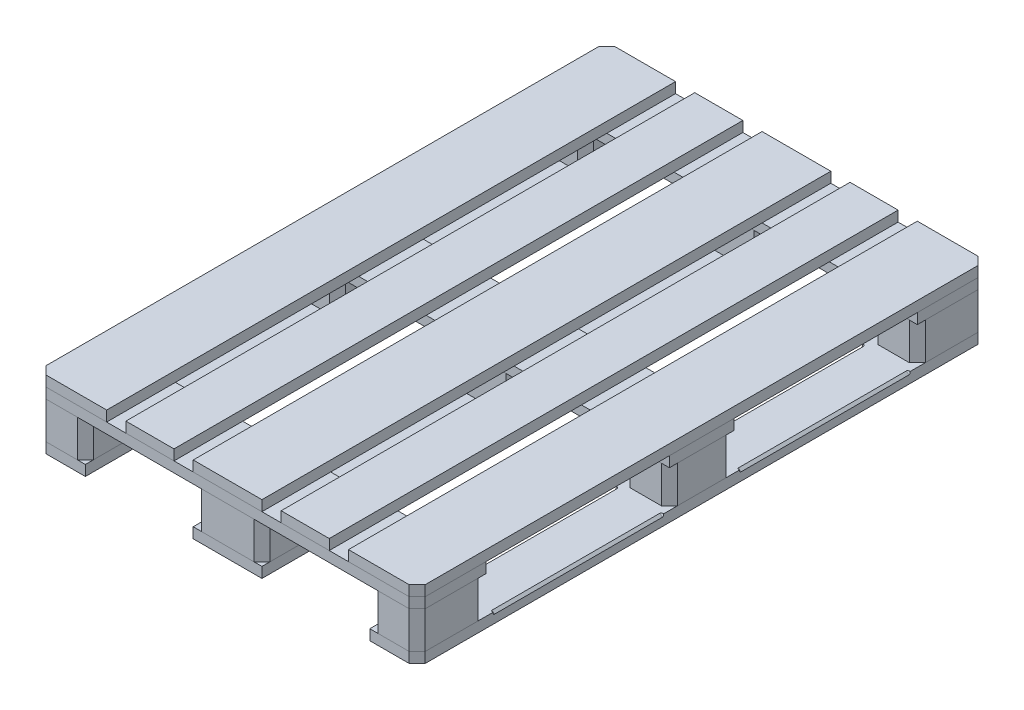
from build123d import *

# Parameters (mm, degrees)
BOSS_EXTRUDE1_DEPTH        = 600
BOSS_EXTRUDE1_DEPTH_BACK   = 600
SKETCH3_W                  = 100
SKETCH3_H                  = 22
BOSS_EXTRUDE1_2_DEPTH      = 600
BOSS_EXTRUDE1_2_DEPTH_BACK = 600
SKETCH3_W_2                = 145
BOSS_EXTRUDE1_3_DEPTH      = 600
BOSS_EXTRUDE1_3_DEPTH_BACK = 600
BOSS_EXTRUDE2_DEPTH        = 78
BOSS_EXTRUDE2_2_DEPTH      = 78
BOSS_EXTRUDE2_3_DEPTH      = 78
BOSS_EXTRUDE2_4_DEPTH      = 78
BOSS_EXTRUDE2_5_DEPTH      = 78
BOSS_EXTRUDE2_6_DEPTH      = 78
BOSS_EXTRUDE2_7_DEPTH      = 78
BOSS_EXTRUDE2_8_DEPTH      = 78
BOSS_EXTRUDE2_9_DEPTH      = 78
SKETCH5_W                  = 800
SKETCH5_H                  = 145
BOSS_EXTRUDE3_DEPTH        = 22
SKETCH5_H_2                = 136
BOSS_EXTRUDE3_2_DEPTH      = 22
BOSS_EXTRUDE3_3_DEPTH      = 22
SKETCH6_W                  = 145
SKETCH6_H                  = 1200
BOSS_EXTRUDE4_DEPTH        = 22
BOSS_EXTRUDE4_2_DEPTH      = 22
BOSS_EXTRUDE4_3_DEPTH      = 22
SKETCH6_W_2                = 101.5
BOSS_EXTRUDE4_4_DEPTH      = 22
BOSS_EXTRUDE4_5_DEPTH      = 22
CUT_EXTRUDE1_DEPTH         = 732.35764165
CUT_EXTRUDE1_DEPTH_BACK    = 732.35764165
CUT_EXTRUDE2_START         = 80
CUT_EXTRUDE2_DEPTH         = 360
CUT_EXTRUDE3_START         = -80
CUT_EXTRUDE3_DEPTH         = 360
FILLET1_R                  = 3
FILLET2_R                  = 3
FILLET3_R                  = 3


with BuildPart() as part:
    # Sketch3 → Boss-Extrude1 (new, two sides: drawn at the far end of the back side and taken through both)
    with BuildSketch(Plane.XY.offset(-BOSS_EXTRUDE1_DEPTH_BACK)):
        with Locations((-350, -61)):
            Rectangle(SKETCH3_W, SKETCH3_H)
    extrude(amount=BOSS_EXTRUDE1_DEPTH + BOSS_EXTRUDE1_DEPTH_BACK)


with BuildPart() as body_2:
    # Sketch3 → Boss-Extrude1 2 (new, two sides: drawn at the far end of the back side and taken through both)
    with BuildSketch(Plane.XY.offset(-BOSS_EXTRUDE1_2_DEPTH_BACK)):
        with Locations((0, -61)):
            Rectangle(SKETCH3_W_2, SKETCH3_H)
    extrude(amount=BOSS_EXTRUDE1_2_DEPTH + BOSS_EXTRUDE1_2_DEPTH_BACK)


with BuildPart() as body_3:
    # Sketch3 → Boss-Extrude1 3 (new, two sides: drawn at the far end of the back side and taken through both)
    with BuildSketch(Plane.XY.offset(-BOSS_EXTRUDE1_3_DEPTH_BACK)):
        with Locations((350, -61)):
            Rectangle(SKETCH3_W, SKETCH3_H)
    extrude(amount=BOSS_EXTRUDE1_3_DEPTH + BOSS_EXTRUDE1_3_DEPTH_BACK)


with BuildPart() as body_4:
    # Sketch4 → Boss-Extrude2 (new body)
    with BuildSketch(Plane(origin=(0, -50, 0), x_dir=(1, 0, 0), z_dir=(0, 1, 0))):
        Polygon((-55.5, -600), (55.5, -600), (72.5, -583), (72.5, -472), (55.5, -455), (-55.5, -455), (-72.5, -472), (-72.5, -583), align=None)
    extrude(amount=BOSS_EXTRUDE2_DEPTH)


with BuildPart() as body_5:
    # Sketch4 → Boss-Extrude2 2 (new body)
    with BuildSketch(Plane(origin=(0, -50, 0), x_dir=(1, 0, 0), z_dir=(0, 1, 0))):
        Polygon((55.5, 600), (-55.5, 600), (-72.5, 583), (-72.5, 472), (-55.5, 455), (55.5, 455), (72.5, 472), (72.5, 583), align=None)
    extrude(amount=BOSS_EXTRUDE2_2_DEPTH)


with BuildPart() as body_6:
    # Sketch4 → Boss-Extrude2 3 (new body)
    with BuildSketch(Plane(origin=(0, -50, 0), x_dir=(1, 0, 0), z_dir=(0, 1, 0))):
        Polygon((383, 600), (317, 600), (300, 583), (300, 472), (317, 455), (383, 455), (400, 472), (400, 583), align=None)
    extrude(amount=BOSS_EXTRUDE2_3_DEPTH)


with BuildPart() as body_7:
    # Sketch4 → Boss-Extrude2 4 (new body)
    with BuildSketch(Plane(origin=(0, -50, 0), x_dir=(1, 0, 0), z_dir=(0, 1, 0))):
        Polygon((-55.5, 68), (55.5, 68), (72.5, 51), (72.5, -51), (55.5, -68), (-55.5, -68), (-72.5, -51), (-72.5, 51), align=None)
    extrude(amount=BOSS_EXTRUDE2_4_DEPTH)


with BuildPart() as body_8:
    # Sketch4 → Boss-Extrude2 5 (new body)
    with BuildSketch(Plane(origin=(0, -50, 0), x_dir=(1, 0, 0), z_dir=(0, 1, 0))):
        Polygon((-317, 600), (-383, 600), (-400, 583), (-400, 472), (-383, 455), (-317, 455), (-300, 472), (-300, 583), align=None)
    extrude(amount=BOSS_EXTRUDE2_5_DEPTH)


with BuildPart() as body_9:
    # Sketch4 → Boss-Extrude2 6 (new body)
    with BuildSketch(Plane(origin=(0, -50, 0), x_dir=(1, 0, 0), z_dir=(0, 1, 0))):
        Polygon((-383, -600), (-317, -600), (-300, -583), (-300, -472), (-317, -455), (-383, -455), (-400, -472), (-400, -583), align=None)
    extrude(amount=BOSS_EXTRUDE2_6_DEPTH)


with BuildPart() as body_10:
    # Sketch4 → Boss-Extrude2 7 (new body)
    with BuildSketch(Plane(origin=(0, -50, 0), x_dir=(1, 0, 0), z_dir=(0, 1, 0))):
        Polygon((317, -600), (383, -600), (400, -583), (400, -472), (383, -455), (317, -455), (300, -472), (300, -583), align=None)
    extrude(amount=BOSS_EXTRUDE2_7_DEPTH)


with BuildPart() as body_11:
    # Sketch4 → Boss-Extrude2 8 (new body)
    with BuildSketch(Plane(origin=(0, -50, 0), x_dir=(1, 0, 0), z_dir=(0, 1, 0))):
        Polygon((383, 68), (317, 68), (300, 51), (300, -51), (317, -68), (383, -68), (400, -51), (400, 51), align=None)
    extrude(amount=BOSS_EXTRUDE2_8_DEPTH)


with BuildPart() as body_12:
    # Sketch4 → Boss-Extrude2 9 (new body)
    with BuildSketch(Plane(origin=(0, -50, 0), x_dir=(1, 0, 0), z_dir=(0, 1, 0))):
        Polygon((-317, 68), (-383, 68), (-400, 51), (-400, -51), (-383, -68), (-317, -68), (-300, -51), (-300, 51), align=None)
    extrude(amount=BOSS_EXTRUDE2_9_DEPTH)


with BuildPart() as body_13:
    # Sketch5 → Boss-Extrude3 (new body)
    with BuildSketch(Plane(origin=(0, 28, 0), x_dir=(1, 0, 0), z_dir=(0, 1, 0))):
        with Locations((0, -527.5)):
            Rectangle(SKETCH5_W, SKETCH5_H)
    extrude(amount=BOSS_EXTRUDE3_DEPTH)


with BuildPart() as body_14:
    # Sketch5 → Boss-Extrude3 2 (new body)
    with BuildSketch(Plane(origin=(0, 28, 0), x_dir=(1, 0, 0), z_dir=(0, 1, 0))):
        Rectangle(SKETCH5_W, SKETCH5_H_2)
    extrude(amount=BOSS_EXTRUDE3_2_DEPTH)


with BuildPart() as body_15:
    # Sketch5 → Boss-Extrude3 3 (new body)
    with BuildSketch(Plane(origin=(0, 28, 0), x_dir=(1, 0, 0), z_dir=(0, 1, 0))):
        with Locations((0, 527.5)):
            Rectangle(SKETCH5_W, SKETCH5_H)
    extrude(amount=BOSS_EXTRUDE3_3_DEPTH)


with BuildPart() as body_16:
    # Sketch6 → Boss-Extrude4 (new body)
    with BuildSketch(Plane(origin=(0, 50, 0), x_dir=(1, 0, 0), z_dir=(0, 1, 0))):
        Rectangle(SKETCH6_W, SKETCH6_H)
    extrude(amount=BOSS_EXTRUDE4_DEPTH)


with BuildPart() as body_17:
    # Sketch6 → Boss-Extrude4 2 (new body)
    with BuildSketch(Plane(origin=(0, 50, 0), x_dir=(1, 0, 0), z_dir=(0, 1, 0))):
        with Locations((-327.5, 0)):
            Rectangle(SKETCH6_W, SKETCH6_H)
    extrude(amount=BOSS_EXTRUDE4_2_DEPTH)


with BuildPart() as body_18:
    # Sketch6 → Boss-Extrude4 3 (new body)
    with BuildSketch(Plane(origin=(0, 50, 0), x_dir=(1, 0, 0), z_dir=(0, 1, 0))):
        with Locations((327.5, 0)):
            Rectangle(SKETCH6_W, SKETCH6_H)
    extrude(amount=BOSS_EXTRUDE4_3_DEPTH)


with BuildPart() as body_19:
    # Sketch6 → Boss-Extrude4 4 (new body)
    with BuildSketch(Plane(origin=(0, 50, 0), x_dir=(1, 0, 0), z_dir=(0, 1, 0))):
        with Locations((163.75, 0)):
            Rectangle(SKETCH6_W_2, SKETCH6_H)
    extrude(amount=BOSS_EXTRUDE4_4_DEPTH)


with BuildPart() as body_20:
    # Sketch6 → Boss-Extrude4 5 (new body)
    with BuildSketch(Plane(origin=(0, 50, 0), x_dir=(1, 0, 0), z_dir=(0, 1, 0))):
        with Locations((-163.75, 0)):
            Rectangle(SKETCH6_W_2, SKETCH6_H)
    extrude(amount=BOSS_EXTRUDE4_5_DEPTH)


with BuildPart() as cut_extrude1_tool:
    # Sketch7 → Cut-Extrude1 (new, two sides: drawn at the far end of the back side and taken through both)
    with BuildSketch(Plane(origin=(0, -50, 0), x_dir=(1, 0, 0), z_dir=(0, 1, 0)).offset(-CUT_EXTRUDE1_DEPTH_BACK)):
        Polygon((383, -600), (400, -583), (400, -600), align=None)
        Polygon((400, 583), (383, 600), (400, 600), align=None)
        Polygon((-400, 600), (-383, 600), (-400, 583), align=None)
        Polygon((-400, -583), (-400, -600), (-383, -600), align=None)
    extrude(amount=CUT_EXTRUDE1_DEPTH + CUT_EXTRUDE1_DEPTH_BACK)


with BuildPart() as part_1:
    add(part.part)

    # Cut-Extrude1: cut by cut_extrude1_tool
    add(cut_extrude1_tool.part, mode=Mode.SUBTRACT)


with BuildPart() as body_3_1:
    add(body_3.part)

    # Cut-Extrude1: cut by cut_extrude1_tool
    add(cut_extrude1_tool.part, mode=Mode.SUBTRACT)


with BuildPart() as body_13_1:
    add(body_13.part)

    # Cut-Extrude1: cut by cut_extrude1_tool
    add(cut_extrude1_tool.part, mode=Mode.SUBTRACT)


with BuildPart() as body_15_1:
    add(body_15.part)

    # Cut-Extrude1: cut by cut_extrude1_tool
    add(cut_extrude1_tool.part, mode=Mode.SUBTRACT)


with BuildPart() as body_17_1:
    add(body_17.part)

    # Cut-Extrude1: cut by cut_extrude1_tool
    add(cut_extrude1_tool.part, mode=Mode.SUBTRACT)


with BuildPart() as body_18_1:
    add(body_18.part)

    # Cut-Extrude1: cut by cut_extrude1_tool
    add(cut_extrude1_tool.part, mode=Mode.SUBTRACT)


with BuildPart() as cut_extrude2_tool:
    # Sketch8 → Cut-Extrude2 (new body)
    with BuildSketch(Plane.XY.offset(CUT_EXTRUDE2_START)):
        Polygon((400, -55), (395, -50), (400, -50), align=None)
        Polygon((300, -50), (305, -50), (300, -55), align=None)
        Polygon((67.5, -50), (72.5, -50), (72.5, -55), align=None)
        Polygon((-72.5, -55), (-67.5, -50), (-72.5, -50), align=None)
        Polygon((-300, -55), (-300, -50), (-305, -50), align=None)
        Polygon((-400, -50), (-400, -55), (-395, -50), align=None)
    extrude(amount=CUT_EXTRUDE2_DEPTH)


with BuildPart() as part_2:
    add(part_1.part)

    # Cut-Extrude2: cut by cut_extrude2_tool
    add(cut_extrude2_tool.part, mode=Mode.SUBTRACT)


with BuildPart() as body_2_1:
    add(body_2.part)

    # Cut-Extrude2: cut by cut_extrude2_tool
    add(cut_extrude2_tool.part, mode=Mode.SUBTRACT)


with BuildPart() as body_3_2:
    add(body_3_1.part)

    # Cut-Extrude2: cut by cut_extrude2_tool
    add(cut_extrude2_tool.part, mode=Mode.SUBTRACT)


with BuildPart() as cut_extrude3_tool:
    # Sketch8<2> → Cut-Extrude3 (new body)
    with BuildSketch(Plane.XY.offset(CUT_EXTRUDE3_START)):
        Polygon((400, -55), (395, -50), (400, -50), align=None)
        Polygon((300, -50), (305, -50), (300, -55), align=None)
        Polygon((67.5, -50), (72.5, -50), (72.5, -55), align=None)
        Polygon((-72.5, -55), (-67.5, -50), (-72.5, -50), align=None)
        Polygon((-300, -55), (-300, -50), (-305, -50), align=None)
        Polygon((-400, -50), (-400, -55), (-395, -50), align=None)
    extrude(amount=-CUT_EXTRUDE3_DEPTH)


with BuildPart() as part_3:
    add(part_2.part)

    # Cut-Extrude3: cut by cut_extrude3_tool
    add(cut_extrude3_tool.part, mode=Mode.SUBTRACT)

    # Fillet3
    fillet3_edges = [part_3.edges().sort_by_distance(p)[0] for p in [
        (-397.5, -52.5, 80),
        (-397.5, -52.5, 440),
        (-302.5, -52.5, -440),
        (-302.5, -52.5, -80),
        (-397.5, -52.5, -440),
        (-397.5, -52.5, -80),
        (-302.5, -52.5, 80),
        (-302.5, -52.5, 440),
    ]]
    fillet(fillet3_edges, radius=FILLET3_R)


with BuildPart() as body_2_2:
    add(body_2_1.part)

    # Cut-Extrude3: cut by cut_extrude3_tool
    add(cut_extrude3_tool.part, mode=Mode.SUBTRACT)

    # Fillet2
    fillet2_edges = [body_2_2.edges().sort_by_distance(p)[0] for p in [
        (-70, -52.5, -80),
        (70, -52.5, 80),
        (70, -52.5, 440),
        (-70, -52.5, 80),
        (-70, -52.5, 440),
        (70, -52.5, -440),
        (70, -52.5, -80),
        (-70, -52.5, -440),
    ]]
    fillet(fillet2_edges, radius=FILLET2_R)


with BuildPart() as body_3_3:
    add(body_3_2.part)

    # Cut-Extrude3: cut by cut_extrude3_tool
    add(cut_extrude3_tool.part, mode=Mode.SUBTRACT)

    # Fillet1
    fillet1_edges = [body_3_3.edges().sort_by_distance(p)[0] for p in [
        (397.5, -52.5, -440),
        (397.5, -52.5, -80),
        (302.5, -52.5, -440),
        (302.5, -52.5, -80),
        (397.5, -52.5, 80),
        (397.5, -52.5, 440),
        (302.5, -52.5, 80),
        (302.5, -52.5, 440),
    ]]
    fillet(fillet1_edges, radius=FILLET1_R)


solid = Compound([body_4.part, body_5.part, body_6.part, body_7.part, body_8.part, body_9.part, body_10.part, body_11.part, body_12.part, body_14.part, body_16.part, body_19.part, body_20.part, body_13_1.part, body_15_1.part, body_17_1.part, body_18_1.part, part_3.part, body_2_2.part, body_3_3.part])
